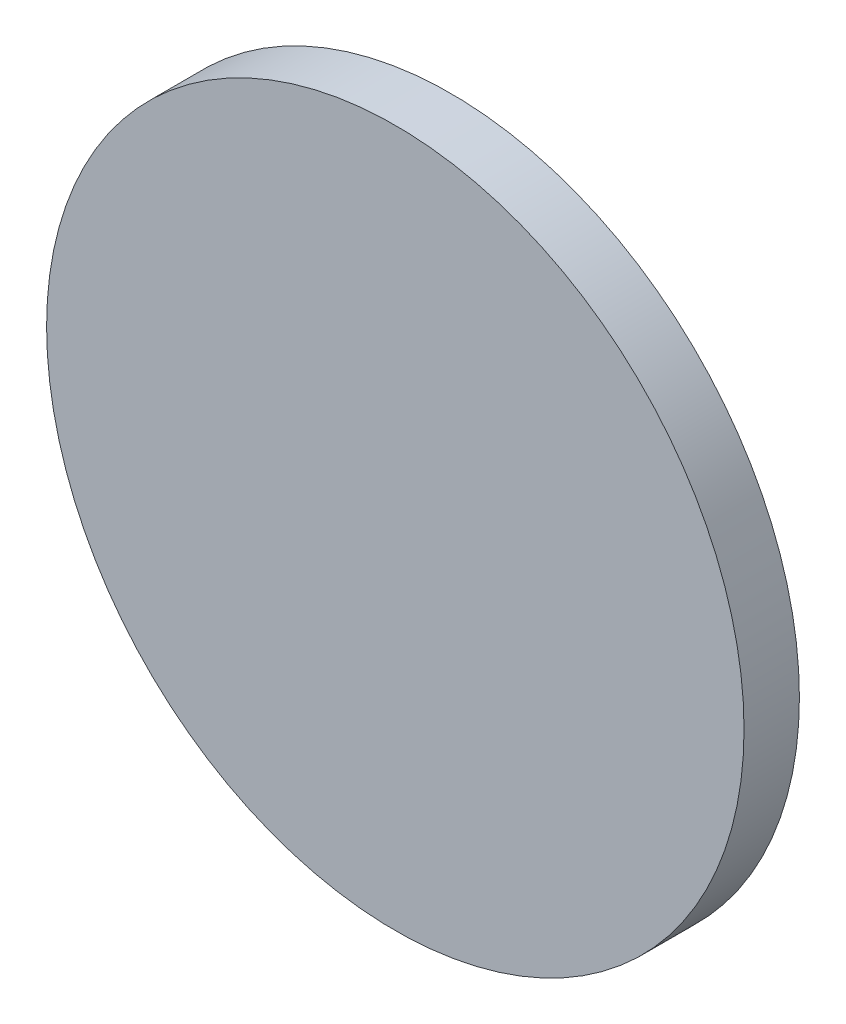
from build123d import *

# Parameters (mm, degrees)
SKETCH2_R           = 20
BOSS_EXTRUDE1_DEPTH = 3.175


with BuildPart() as part:
    # Sketch2 → Boss-Extrude1 (new body)
    with BuildSketch(Plane.XY):
        Circle(SKETCH2_R)
    extrude(amount=BOSS_EXTRUDE1_DEPTH)


solid = part.part
